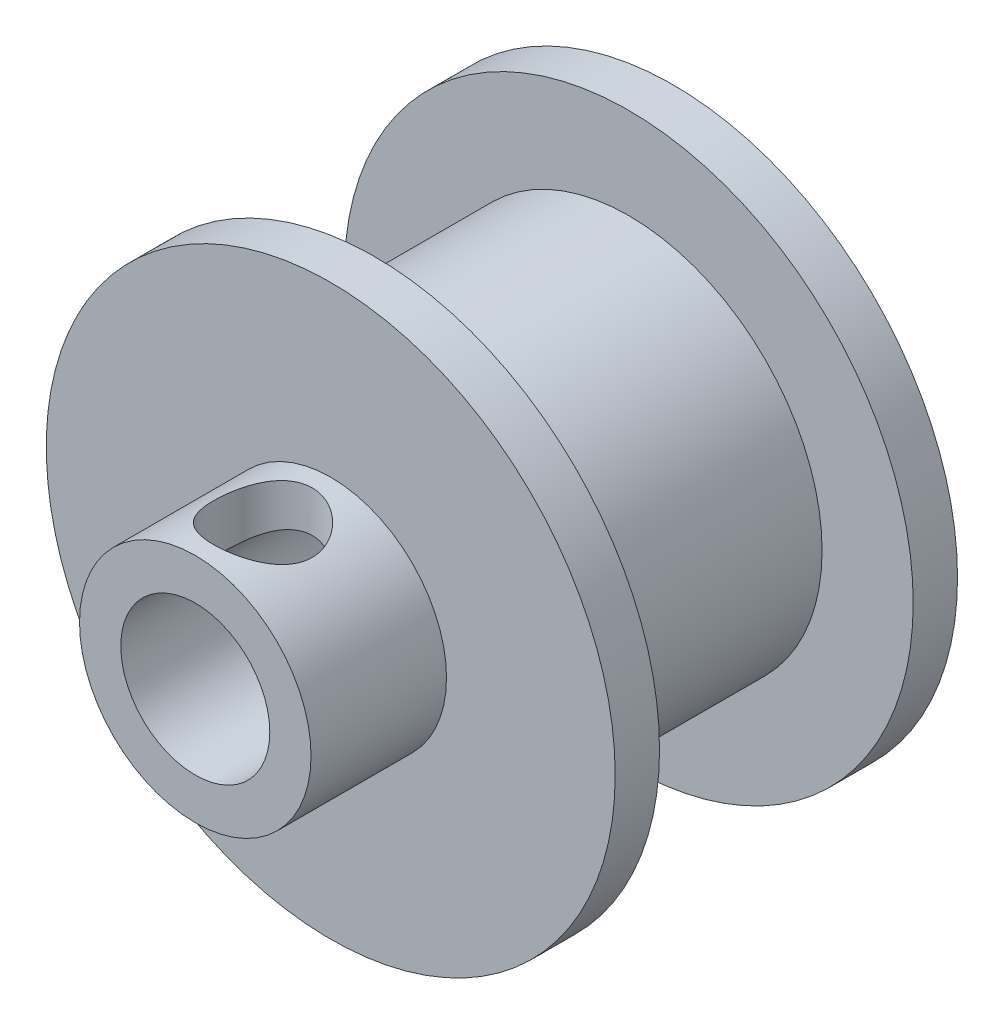
from build123d import *

# Parameters (mm, degrees)
ESQUISSE1_R             = 11.55
ESQUISSE1_R_2           = 3.025
BOSS_EXTRU_1_DEPTH      = 6.95
ESQUISSE2_R             = 13.660407535
ESQUISSE2_R_2           = 7.85
ENL_V_MAT_EXTRU_1_DEPTH = 5.15
ESQUISSE4_R             = 4.7
ESQUISSE4_R_2           = 3.025
BOSS_EXTRU_2_DEPTH      = 5.5
ESQUISSE5_R             = 2
ENL_V_MAT_EXTRU_3_DEPTH = 21.537952673


with BuildPart() as part:
    # Esquisse1 → Boss.-Extru.1 (new, symmetric)
    with BuildSketch(Plane.XY):
        Circle(ESQUISSE1_R)
        Circle(ESQUISSE1_R_2, mode=Mode.SUBTRACT)
    extrude(amount=BOSS_EXTRU_1_DEPTH, both=True)

    # Esquisse2 → Enlèv. mat.-Extru.1 (cut, symmetric)
    with BuildSketch(Plane.XY):
        Circle(ESQUISSE2_R)
        Circle(ESQUISSE2_R_2, mode=Mode.SUBTRACT)
    extrude(amount=ENL_V_MAT_EXTRU_1_DEPTH, both=True, mode=Mode.SUBTRACT)

    # Esquisse4 → Boss.-Extru.2 (add)
    with BuildSketch(Plane.XY.offset(6.95)):
        Circle(ESQUISSE4_R)
        Circle(ESQUISSE4_R_2, mode=Mode.SUBTRACT)
    extrude(amount=BOSS_EXTRU_2_DEPTH)

    # Esquisse5 → Enlèv. mat.-Extru.3 (cut, through all)
    with BuildSketch(Plane(origin=(0, 0, 0), x_dir=(1, 0, 0), z_dir=(0, 1, 0))):
        with Locations(Location((0, -9.7, 0), (0, 0, 90))):
            Circle(ESQUISSE5_R)
    extrude(amount=ENL_V_MAT_EXTRU_3_DEPTH, mode=Mode.SUBTRACT)


solid = part.part
